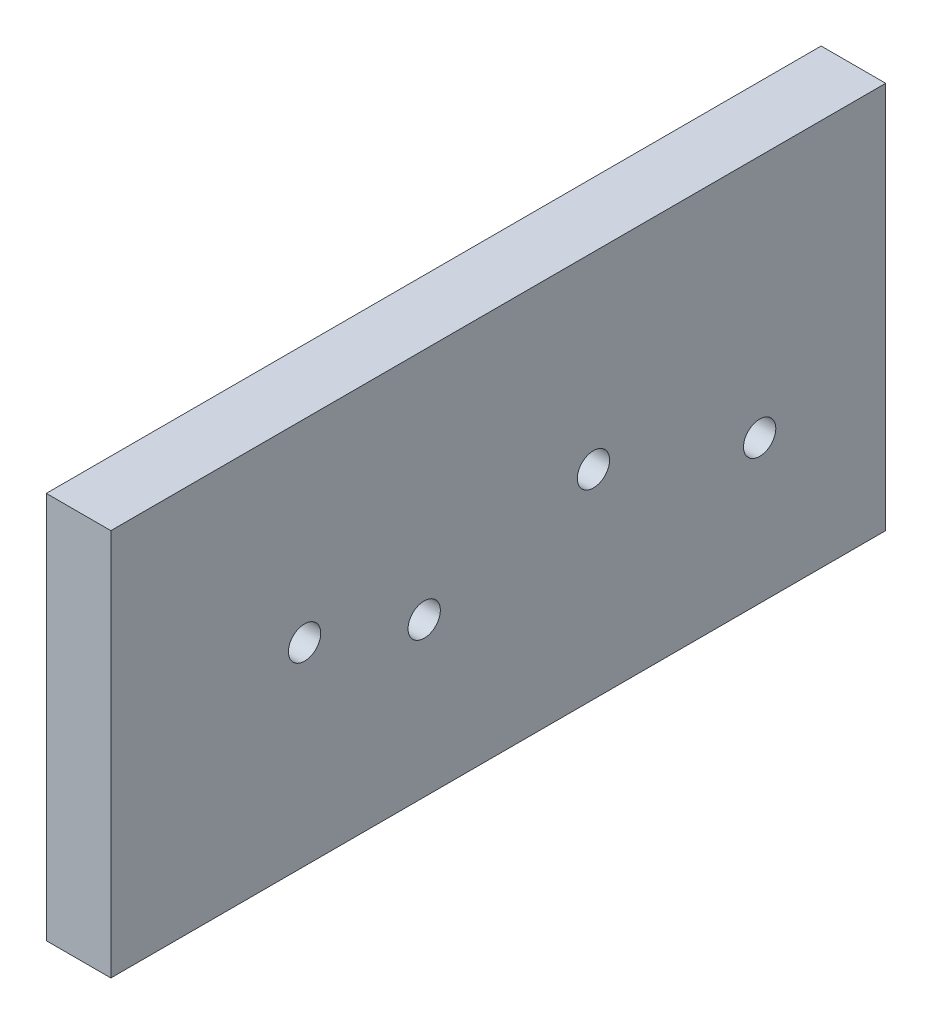
from build123d import *

# Parameters (mm, degrees)
SKETCH1_W                       = 152.4
SKETCH1_H                       = 76.2
SKETCH1_R                       = 3.175
BOSS_EXTRUDE1_DEPTH             = 12.7
SKETCH2_R                       = 7.9375
CUT_EXTRUDE1_DEPTH              = 6.35
F_1_4_0_25_DIAMETER_HOLE1_D     = 6.35
F_1_4_0_25_DIAMETER_HOLE1_DEPTH = 12.7
F_1_4_0_25_DIAMETER_HOLE1_TIP   = 1.907732465


with BuildPart() as part:
    # Sketch1 → Boss-Extrude1 (new body)
    with BuildSketch(Plane(origin=(0, 0, 0), x_dir=(0, 0, -1), z_dir=(1, 0, 0))):
        Rectangle(SKETCH1_W, SKETCH1_H)
        with Locations((18.72253158, 1.096077429)):
            Circle(SKETCH1_R, mode=Mode.SUBTRACT)
        with Locations((-38.1, 0)):
            Circle(SKETCH1_R, mode=Mode.SUBTRACT)
        with Locations((-14.571224015, -7.860160654)):
            Circle(SKETCH1_R, mode=Mode.SUBTRACT)
        with Locations((51.408255992, -9.873506971)):
            Circle(SKETCH1_R, mode=Mode.SUBTRACT)
    extrude(amount=BOSS_EXTRUDE1_DEPTH)

    # Sketch2 → Cut-Extrude1 (cut)
    with BuildSketch(Plane.ZY):
        with Locations((38.1, 0)):
            Circle(SKETCH2_R)
        with Locations((14.571224015, -7.860160654)):
            Circle(SKETCH2_R)
        with Locations((-18.72253158, 1.096077429)):
            Circle(SKETCH2_R)
        with Locations((-51.408255992, -9.873506971)):
            Circle(SKETCH2_R)
    extrude(amount=-CUT_EXTRUDE1_DEPTH, mode=Mode.SUBTRACT)

    # 1/4 (0.25) Diameter Hole1
    with Locations(Plane.XZ.offset(38.1)):
        with Locations((6.35, -63.5), (6.35, 0), (6.35, 57.15)):
            Hole(F_1_4_0_25_DIAMETER_HOLE1_D / 2, depth=F_1_4_0_25_DIAMETER_HOLE1_DEPTH)
            with Locations((0, 0, -(F_1_4_0_25_DIAMETER_HOLE1_DEPTH + F_1_4_0_25_DIAMETER_HOLE1_TIP / 2))):  # 118° drill point
                Cone(0, F_1_4_0_25_DIAMETER_HOLE1_D / 2, F_1_4_0_25_DIAMETER_HOLE1_TIP, mode=Mode.SUBTRACT)


solid = part.part
